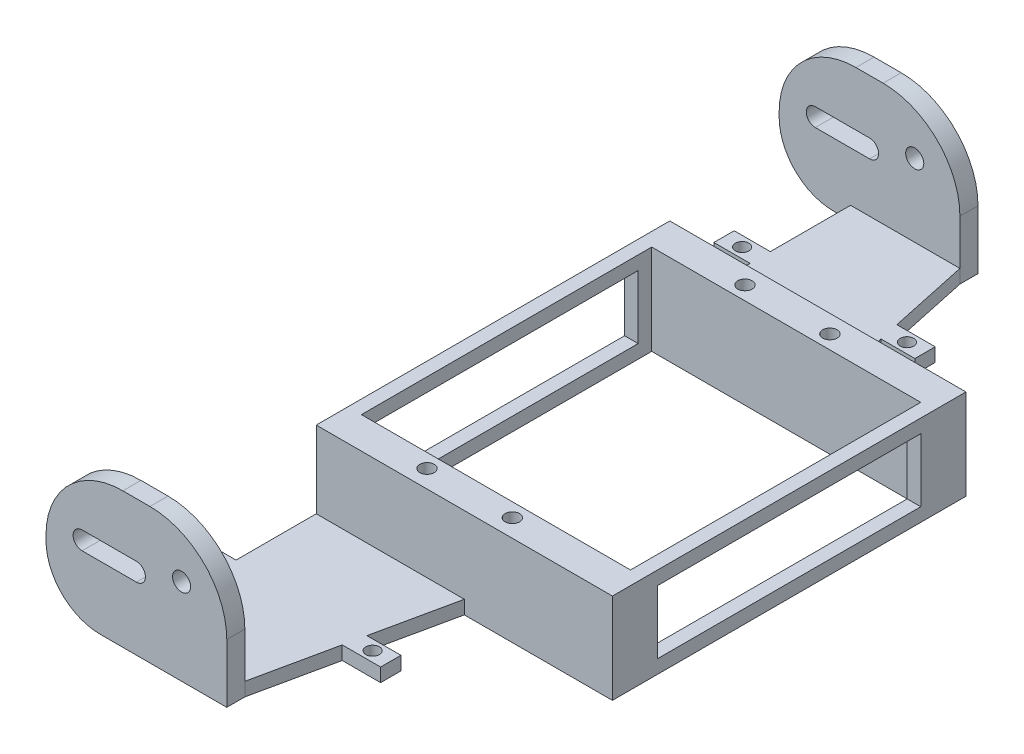
from build123d import *

# Parameters (mm, degrees)
SKETCH1_R               = 1.6
SKETCH1_R_2             = 1.599939077
SKETCH1_W               = 59.532
SKETCH1_H               = 64.229021166
SKETCH1_R_3             = 1.599995589
SKETCH1_R_4             = 1.5
BOSS_EXTRUDE1_DEPTH     = 3
SKETCH2_W               = 40
SKETCH2_H               = 4
BOSS_EXTRUDE2_DEPTH     = 30
CUT_EXTRUDE1_DEPTH      = 111.01120349
CUT_EXTRUDE1_DEPTH_BACK = 111.01120349
SKETCH3_R               = 2
FILLET2_R               = 17
FILLET3_R               = 12
SKETCH1_8_R             = 1.6
SKETCH1_8_R_2           = 1.599939077
SKETCH1_8_W             = 59.532
SKETCH1_8_H             = 64.229021166
SKETCH1_8_R_3           = 1.599995589
BOSS_EXTRUDE3_DEPTH     = 20
SKETCH5_R               = 2.5
CUT_EXTRUDE2_DEPTH      = 5
SKETCH7_W               = 58.229021166
SKETCH7_H               = 14
CUT_EXTRUDE3_DEPTH      = 111.01120349


with BuildPart() as part:
    # Sketch1 → Boss-Extrude1 (new body)
    with BuildSketch(Plane(origin=(0, 0, 0), x_dir=(1, 0, 0), z_dir=(0, 1, 0))):
        Polygon((65.532, 39.114510583), (32.766, 39.114510583), (28.9648375, 56.864510583), (36.483, 56.864510583), (36.483, 61.364510583), (28.0011625, 61.364510583), (24.2, 79.114510583), (0, 79.114510583), (0, 61.364510583), (-8, 61.364510583), (-8, 56.864510583), (0, 56.864510583), (0, -56.864510583), (-8, -56.864510583), (-8, -61.364510583), (0, -61.364510583), (0, -79.114510583), (24.2, -79.114510583), (28.0011625, -61.364510583), (36.483, -61.364510583), (36.483, -56.864510583), (28.9648375, -56.864510583), (32.766, -39.114510583), (65.532, -39.114510583), align=None)
        with Locations((20.574, -35.179510583)):
            Circle(SKETCH1_R, mode=Mode.SUBTRACT)
        with Locations((39.450944, -35.179510583)):
            Circle(SKETCH1_R_2, mode=Mode.SUBTRACT)
        with Locations((32.766, 0)):
            Rectangle(SKETCH1_W, SKETCH1_H, mode=Mode.SUBTRACT)
        with Locations((20.574, 35.1758104)):
            Circle(SKETCH1_R_3, mode=Mode.SUBTRACT)
        with Locations((39.37, 35.1758104)):
            Circle(SKETCH1_R_2, mode=Mode.SUBTRACT)
        with Locations((-4, 59.114510583)):
            Circle(SKETCH1_R_4, mode=Mode.SUBTRACT)
        with Locations((32.483, 59.114510583)):
            Circle(SKETCH1_R_4, mode=Mode.SUBTRACT)
        with Locations((32.483, -59.114510583)):
            Circle(SKETCH1_R_4, mode=Mode.SUBTRACT)
        with Locations((-4, -59.114510583)):
            Circle(SKETCH1_R_4, mode=Mode.SUBTRACT)
    extrude(amount=BOSS_EXTRUDE1_DEPTH)

    # Sketch2 → Boss-Extrude2 (add)
    with BuildSketch(Plane(origin=(0, 0, 0), x_dir=(1, 0, 0), z_dir=(0, 1, 0))):
        with Locations((4.2, -81.114510583)):
            Rectangle(SKETCH2_W, SKETCH2_H)
        with Locations((4.2, 81.114510583)):
            Rectangle(SKETCH2_W, SKETCH2_H)
    extrude(amount=BOSS_EXTRUDE2_DEPTH)

    # Sketch3 → Cut-Extrude1 (cut, two sides: drawn at the far end of the back side and taken through both)
    with BuildSketch(Plane.XY.offset(-CUT_EXTRUDE1_DEPTH_BACK)):
        with BuildLine():
            Line((4.2, 18), (-7.8, 18))
            ThreePointArc((-7.8, 18), (-9.8, 16), (-7.8, 14))
            Line((-7.8, 14), (4.2, 14))
            ThreePointArc((4.2, 14), (6.2, 16), (4.2, 18))
        make_face()
        with Locations((14.2, 19.1)):
            Circle(SKETCH3_R)
    extrude(amount=CUT_EXTRUDE1_DEPTH + CUT_EXTRUDE1_DEPTH_BACK, mode=Mode.SUBTRACT)

    # Fillet2
    fillet2_edges = [part.edges().sort_by_distance(p)[0] for p in [
        (-15.8, 30, -81.114510583),
        (24.2, 30, -81.114510583),
        (24.2, 30, 81.114510583),
        (-15.8, 30, 81.114510583),
    ]]
    fillet(fillet2_edges, radius=FILLET2_R)

    # Fillet3
    fillet3_edges = [part.edges().sort_by_distance(p)[0] for p in [
        (-15.8, 0, 81.114510583),
        (-15.8, 0, -81.114510583),
    ]]
    fillet(fillet3_edges, radius=FILLET3_R)

    # Sketch1<8> → Boss-Extrude3 (add)
    with BuildSketch(Plane(origin=(0, 0, 0), x_dir=(1, 0, 0), z_dir=(0, 1, 0))):
        Polygon((32.766, 39.114510583), (0, 39.114510583), (0, -39.114510583), (32.766, -39.114510583), (65.532, -39.114510583), (65.532, 39.114510583), align=None)
        with Locations((20.574, -35.179510583)):
            Circle(SKETCH1_8_R, mode=Mode.SUBTRACT)
        with Locations((39.450944, -35.179510583)):
            Circle(SKETCH1_8_R_2, mode=Mode.SUBTRACT)
        with Locations((32.766, 0)):
            Rectangle(SKETCH1_8_W, SKETCH1_8_H, mode=Mode.SUBTRACT)
        with Locations((20.574, 35.1758104)):
            Circle(SKETCH1_8_R_3, mode=Mode.SUBTRACT)
        with Locations((39.37, 35.1758104)):
            Circle(SKETCH1_8_R_2, mode=Mode.SUBTRACT)
    extrude(amount=BOSS_EXTRUDE3_DEPTH)

    # Sketch5 → Cut-Extrude2 (cut)
    with BuildSketch(Plane(origin=(0, 0, 0), x_dir=(1, 0, 0), z_dir=(0, 1, 0))):
        with Locations((20.574, -35.179510583)):
            Circle(SKETCH5_R)
        with Locations((39.450944, -35.179510583)):
            Circle(SKETCH5_R)
        with Locations((20.574, 35.1758104)):
            Circle(SKETCH5_R)
        with Locations((39.37, 35.1758104)):
            Circle(SKETCH5_R)
    extrude(amount=CUT_EXTRUDE2_DEPTH, mode=Mode.SUBTRACT)

    # Sketch7 → Cut-Extrude3 (cut, through all)
    with BuildSketch(Plane(origin=(0, 0, 0), x_dir=(0, 0, -1), z_dir=(1, 0, 0))):
        with Locations((0, 10)):
            Rectangle(SKETCH7_W, SKETCH7_H)
    extrude(amount=CUT_EXTRUDE3_DEPTH, mode=Mode.SUBTRACT)


solid = part.part
